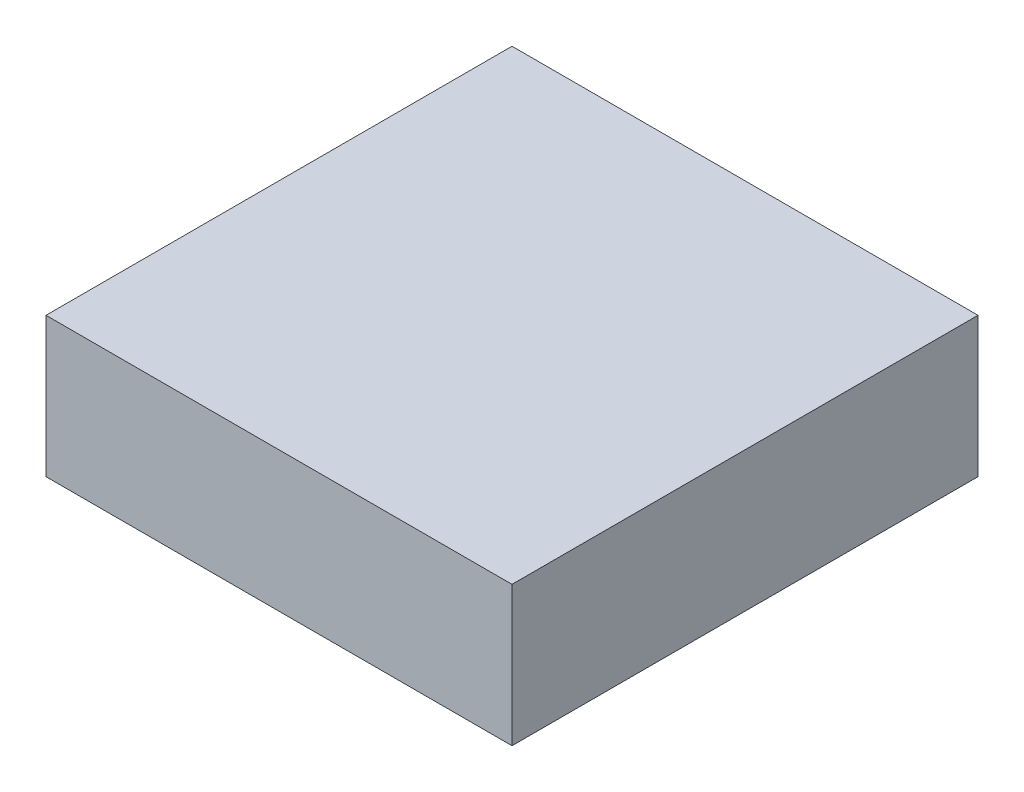
from build123d import *

# Parameters (mm, degrees)
SKETCH1_W           = 20
SKETCH1_H           = 20
BOSS_EXTRUDE1_DEPTH = 6


with BuildPart() as part:
    # Sketch1 → Boss-Extrude1 (new body)
    with BuildSketch(Plane(origin=(0, 0, 0), x_dir=(1, 0, 0), z_dir=(0, 1, 0))):
        with Locations((10, 10)):
            Rectangle(SKETCH1_W, SKETCH1_H)
    extrude(amount=BOSS_EXTRUDE1_DEPTH)


solid = part.part
